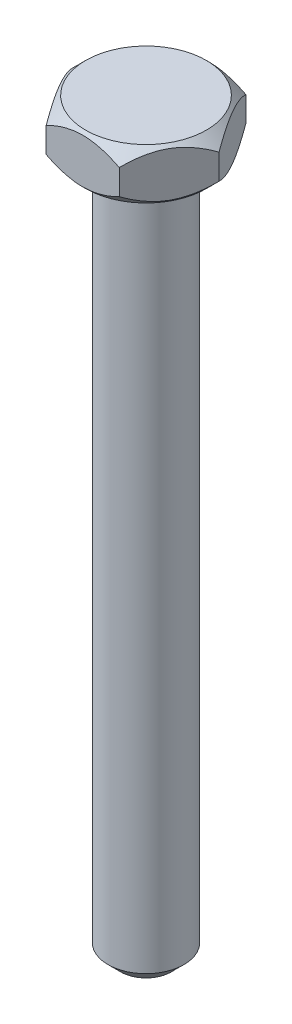
from build123d import *

# Parameters (mm, degrees)
EXTRUDE_1_DEPTH = 4
SKETCH_2_R      = 3
EXTRUDE_2_DEPTH = 55
CHAMFER_2_SIZE  = 1


with BuildPart() as part:
    # Эскиз1 → Вытянуть1 (new body)
    with BuildSketch(Plane(origin=(0, 0, 0), x_dir=(1, 0, 0), z_dir=(0, 1, 0))):
        Polygon((-2.886751346, 5), (2.886751346, 5), (5.773502692, 0), (2.886751346, -5), (-2.886751346, -5), (-5.773502692, 0), align=None)
    extrude(amount=-EXTRUDE_1_DEPTH)

    # Эскиз2 → Вытянуть2 (add)
    with BuildSketch(Plane.XZ.offset(4)):
        with Locations(Location((0, 0, 0), (0, 0, 270))):
            Circle(SKETCH_2_R)
    extrude(amount=EXTRUDE_2_DEPTH)

    # Фаска2
    chamfer_2_edges = [part.edges().sort_by_distance(p)[0] for p in [
        (0, -59, 3),
    ]]
    chamfer(chamfer_2_edges, length=CHAMFER_2_SIZE)

    # Эскиз3 → Вырез-Повернуть1 (revolve, cut)
    with BuildSketch(Plane.XY, mode=Mode.PRIVATE) as cut_revolve_1_sk:
        Polygon((-5.773502692, -1), (-4.773502692, 0), (-5.773502692, 0), align=None)
        Polygon((-5.773502692, -3), (-4.773502692, -4), (-5.773502692, -4), align=None)
    revolve(cut_revolve_1_sk.sketch.rotate(Axis((0, -4, 0), (0, -1, 0)), 270), axis=Axis((0, -4, 0), (0, -1, 0)), mode=Mode.SUBTRACT)


solid = part.part
